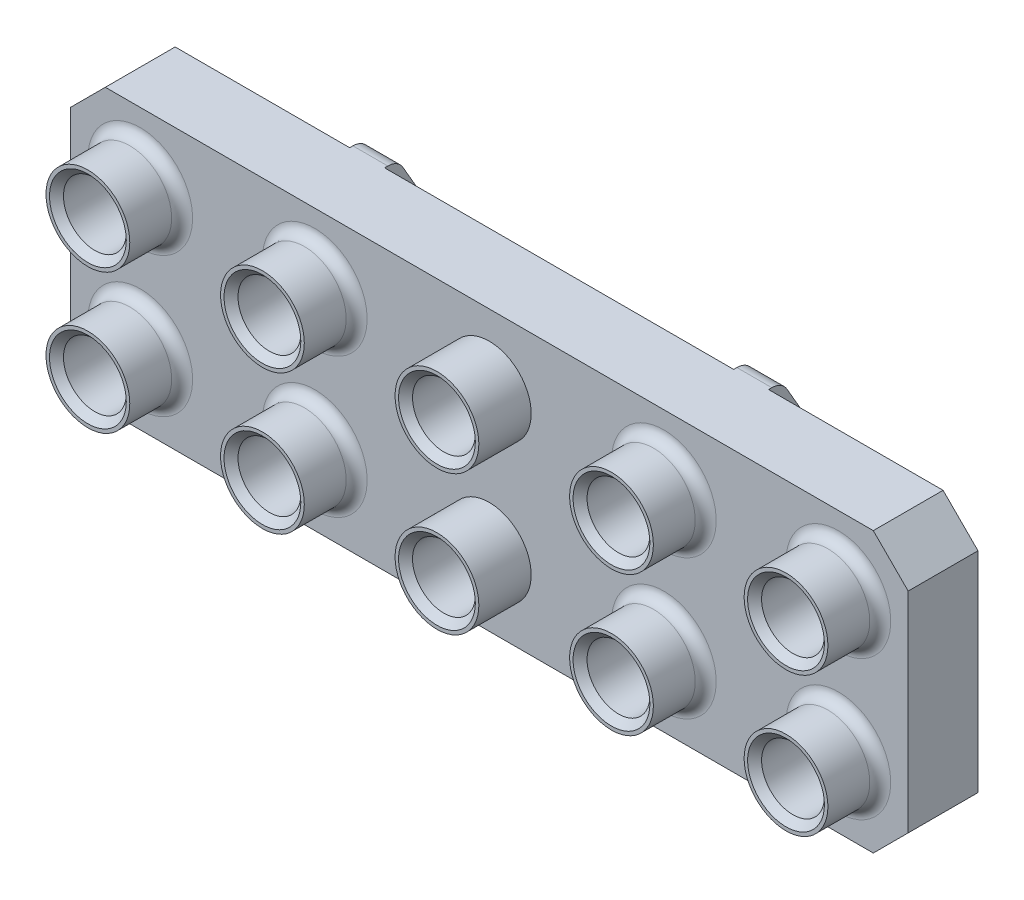
from build123d import *

# Parameters (mm, degrees)
SKETCH_1_W          = 240
SKETCH_1_H          = 80
EXTRUDE_1_DEPTH     = 20
SKETCH_2_R          = 12
SKETCH_2_R_2        = 9
EXTRUDE_2_DEPTH     = 15
CUT_EXTRUDE_START   = -15
SKETCH_3_R          = 9
CUT_EXTRUDE_1_DEPTH = 15
CHAMFER_1_SIZE      = 10
FILLET_1_R          = 3
CHAMFER_2_SIZE      = 2
EXTRUDE_START       = 50
EXTRUDE_3_DEPTH     = 10
FILLET_2_R          = 5


with BuildPart() as part:
    # 草图1 → 凸台-拉伸1 (new body)
    with BuildSketch(Plane.XY):
        Rectangle(SKETCH_1_W, SKETCH_1_H)
    extrude(amount=EXTRUDE_1_DEPTH)

    # 草图2 → 凸台-拉伸2 (add)
    # profile 1 of 10: a face of its own
    with BuildSketch(Plane.XY.offset(20)):
        with Locations(Location((-100, 20, 0), (0, 0, 180))):
            Circle(SKETCH_2_R)
        with Locations((-100, 20)):
            Circle(SKETCH_2_R_2, mode=Mode.SUBTRACT)
    # profile 2 of 10: a face of its own
    with BuildSketch(Plane.XY.offset(20)):
        with Locations(Location((-50, 20, 0), (0, 0, 180))):
            Circle(SKETCH_2_R)
        with Locations((-50, 20)):
            Circle(SKETCH_2_R_2, mode=Mode.SUBTRACT)
    # profile 3 of 10: a face of its own
    with BuildSketch(Plane.XY.offset(20)):
        with Locations(Location((0, 20, 0), (0, 0, 180))):
            Circle(SKETCH_2_R)
        with Locations((0, 20)):
            Circle(SKETCH_2_R_2, mode=Mode.SUBTRACT)
    # profile 4 of 10: a face of its own
    with BuildSketch(Plane.XY.offset(20)):
        with Locations(Location((50, 20, 0), (0, 0, 180))):
            Circle(SKETCH_2_R)
        with Locations((50, 20)):
            Circle(SKETCH_2_R_2, mode=Mode.SUBTRACT)
    # profile 5 of 10: a face of its own
    with BuildSketch(Plane.XY.offset(20)):
        with Locations(Location((100, 20, 0), (0, 0, 180))):
            Circle(SKETCH_2_R)
        with Locations((100, 20)):
            Circle(SKETCH_2_R_2, mode=Mode.SUBTRACT)
    # profile 6 of 10: a face of its own
    with BuildSketch(Plane.XY.offset(20)):
        with Locations(Location((-50, -20, 0), (0, 0, 180))):
            Circle(SKETCH_2_R)
        with Locations((-50, -20)):
            Circle(SKETCH_2_R_2, mode=Mode.SUBTRACT)
    # profile 7 of 10: a face of its own
    with BuildSketch(Plane.XY.offset(20)):
        with Locations(Location((0, -20, 0), (0, 0, 180))):
            Circle(SKETCH_2_R)
        with Locations((0, -20)):
            Circle(SKETCH_2_R_2, mode=Mode.SUBTRACT)
    # profile 8 of 10: a face of its own
    with BuildSketch(Plane.XY.offset(20)):
        with Locations(Location((50, -20, 0), (0, 0, 180))):
            Circle(SKETCH_2_R)
        with Locations((50, -20)):
            Circle(SKETCH_2_R_2, mode=Mode.SUBTRACT)
    # profile 9 of 10: a face of its own
    with BuildSketch(Plane.XY.offset(20)):
        with Locations(Location((100, -20, 0), (0, 0, 180))):
            Circle(SKETCH_2_R)
        with Locations((100, -20)):
            Circle(SKETCH_2_R_2, mode=Mode.SUBTRACT)
    # profile 10 of 10: a face of its own
    with BuildSketch(Plane.XY.offset(20)):
        with Locations(Location((-100, -20, 0), (0, 0, 180))):
            Circle(SKETCH_2_R)
        with Locations((-100, -20)):
            Circle(SKETCH_2_R_2, mode=Mode.SUBTRACT)
    extrude(amount=EXTRUDE_2_DEPTH)

    # 草图3 → 切除-拉伸1 (cut)
    with BuildSketch(Plane.XY.offset(20).offset(CUT_EXTRUDE_START)):
        with Locations((-100, 20)):
            Circle(SKETCH_3_R)
        with Locations((-50, 20)):
            Circle(SKETCH_3_R)
        with Locations((0, 20)):
            Circle(SKETCH_3_R)
        with Locations((50, 20)):
            Circle(SKETCH_3_R)
        with Locations((100, 20)):
            Circle(SKETCH_3_R)
        with Locations((-50, -20)):
            Circle(SKETCH_3_R)
        with Locations((0, -20)):
            Circle(SKETCH_3_R)
        with Locations((50, -20)):
            Circle(SKETCH_3_R)
        with Locations((100, -20)):
            Circle(SKETCH_3_R)
        with Locations((-100, -20)):
            Circle(SKETCH_3_R)
    extrude(amount=CUT_EXTRUDE_1_DEPTH, mode=Mode.SUBTRACT)

    # 倒角1
    chamfer_1_edges = [part.edges().sort_by_distance(p)[0] for p in [
        (120, -40, 10),
        (-120, -40, 10),
        (-120, 40, 10),
        (120, 40, 10),
    ]]
    chamfer(chamfer_1_edges, length=CHAMFER_1_SIZE)

    # 圆角1
    fillet_1_edges = [part.edges().sort_by_distance(p)[0] for p in [
        (-109, 20, 5),
        (-38, 20, 20),
        (-88, 20, 20),
        (62, 20, 20),
        (112, 20, 20),
        (-38, -20, 20),
        (62, -20, 20),
        (112, -20, 20),
        (-88, -20, 20),
        (-109, -20, 5),
        (91, -20, 5),
        (41, -20, 5),
        (-9, -20, 5),
        (-59, -20, 5),
        (91, 20, 5),
        (41, 20, 5),
        (-9, 20, 5),
        (-59, 20, 5),
    ]]
    fillet(fillet_1_edges, radius=FILLET_1_R)

    # 倒角2
    chamfer_2_edges = [part.edges().sort_by_distance(p)[0] for p in [
        (-59, 20, 35),
        (-109, 20, 35),
        (-9, 20, 35),
        (41, 20, 35),
        (91, 20, 35),
        (-59, -20, 35),
        (-9, -20, 35),
        (41, -20, 35),
        (91, -20, 35),
        (-109, -20, 35),
    ]]
    chamfer(chamfer_2_edges, length=CHAMFER_2_SIZE)

    # 草图4 → 凸台-拉伸3 (add)
    with BuildSketch(Plane(origin=(0, 0, 0), x_dir=(0, 0, -1), z_dir=(1, 0, 0)).offset(EXTRUDE_START)):
        Polygon((0, 40), (3.811978465, 40), (50, -40), (0, -40), align=None)
        Polygon((10, 9.282032303), (32.679491924, -30), (10, -30), align=None, mode=Mode.SUBTRACT)
    extrude_3 = extrude(amount=EXTRUDE_3_DEPTH)

    # 镜向1: 凸台-拉伸3 across plane
    add(extrude_3.mirror(Plane(origin=(0, 0, 0), x_dir=(0, 0, 1), z_dir=(1, 0, 0))))

    # 圆角2
    fillet_2_edges = [part.edges().sort_by_distance(p)[0] for p in [
        (55, -40, -50),
        (55, 40, -3.811978465),
        (55, -30, -10),
        (55, -30, -32.679491924),
        (55, 9.282032303, -10),
        (-55, 40, -3.811978465),
        (-55, -40, -50),
        (-55, 9.282032303, -10),
        (-55, -30, -10),
    ]]
    fillet(fillet_2_edges, radius=FILLET_2_R)


solid = part.part
